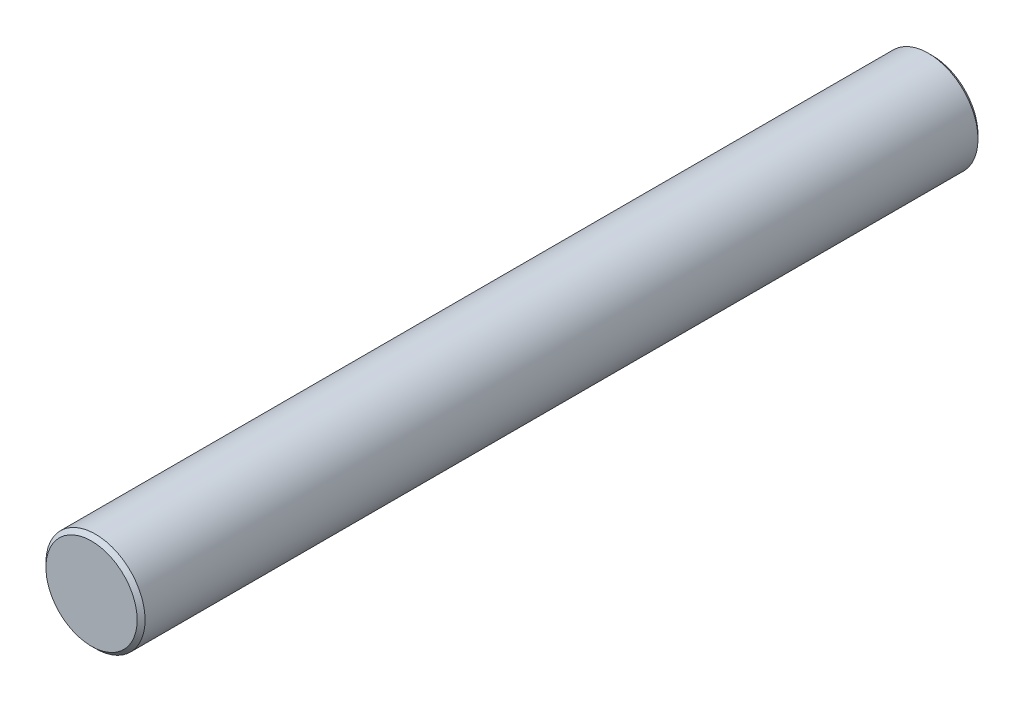
from build123d import *

# Parameters (mm, degrees)
SKETCH_1_R      = 12.5
EXTRUDE_1_DEPTH = 106
CHAMFER_1_SIZE  = 1


with BuildPart() as part:
    # 草图1 → 凸台-拉伸1 (new, symmetric)
    with BuildSketch(Plane.XY):
        Circle(SKETCH_1_R)
    extrude(amount=EXTRUDE_1_DEPTH, both=True)

    # 倒角1
    chamfer_1_edges = [part.edges().sort_by_distance(p)[0] for p in [
        (-12.5, 0, -106),
        (-12.5, 0, 106),
    ]]
    chamfer(chamfer_1_edges, length=CHAMFER_1_SIZE)


solid = part.part
